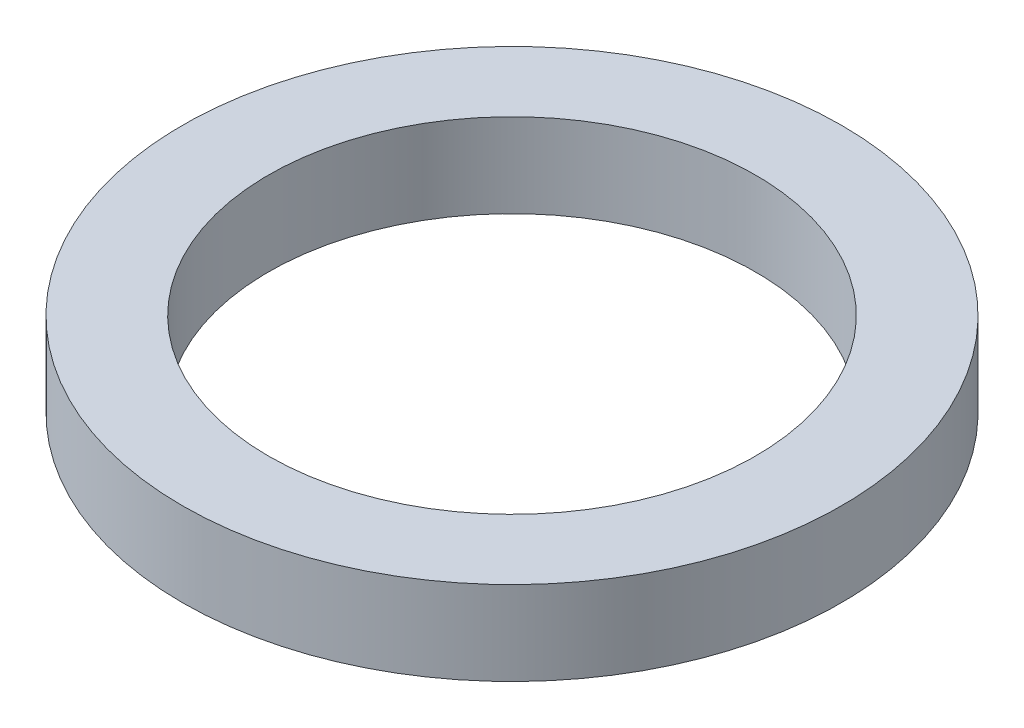
from build123d import *

# Parameters (mm, degrees)
O_RING_START = -1
SKETCH1_R    = 7.85
SKETCH1_R_2  = 5.8
O_RING_DEPTH = 2


with BuildPart() as part:
    # Sketch1 → O_Ring (new body)
    with BuildSketch(Plane(origin=(0, 0, 0), x_dir=(1, 0, 0), z_dir=(0, 1, 0)).offset(O_RING_START)):
        with Locations(Location((0, 0, 0), (0, 0, 270))):
            Circle(SKETCH1_R)
        with Locations(Location((0, 0, 0), (0, 0, 270))):
            Circle(SKETCH1_R_2, mode=Mode.SUBTRACT)
    extrude(amount=O_RING_DEPTH)


solid = part.part
